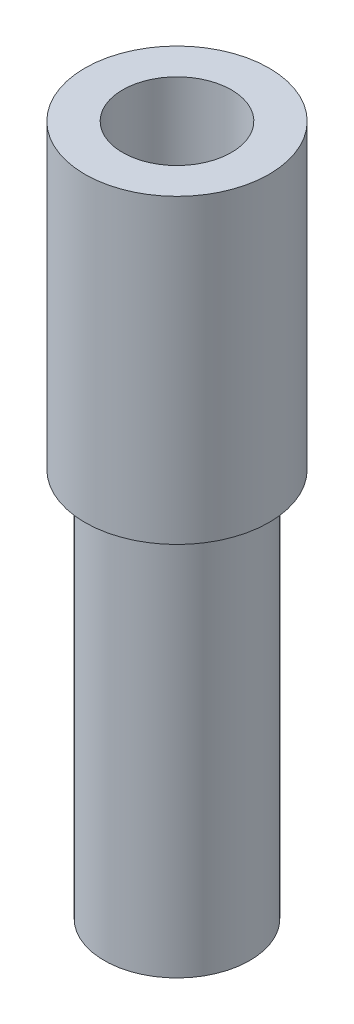
from build123d import *


with BuildPart() as part:
    # 스케치1 → 회전1 (revolve)
    with BuildSketch(Plane(origin=(0, 0, 0), x_dir=(0, 0, -1), z_dir=(1, 0, 0))):
        Polygon((5.904507965, 0), (7.904507965, 0), (7.904507965, 42.254370367), (10, 42.254370367), (10, 75), (5.904507965, 75), (5.904507965, 6.762391945), (4, 6.762391945), (4, 4.968729859), (5.904507965, 4.968729859), align=None)
    revolve(axis=Axis((0, 0, 0), (0, 1, 0)))


solid = part.part
